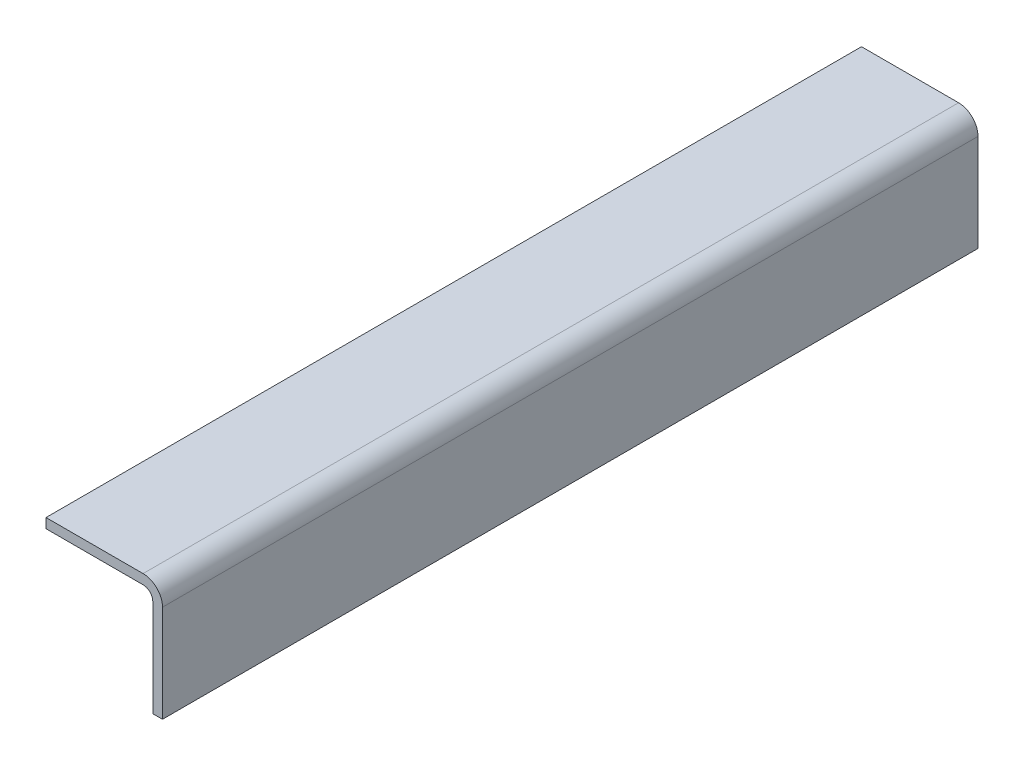
from build123d import *

# Parameters (mm, degrees)
BOSS_EXTRUDE1_DEPTH = 133.35
FILLET2_R           = 3.175
FILLET3_R           = 6.35


with BuildPart() as part:
    # Sketch1 → Boss-Extrude1 (new, symmetric)
    with BuildSketch(Plane.XY):
        Polygon((-3.175, 0), (0, 0), (0, 38.1), (-38.1, 38.1), (-38.1, 34.925), (-3.175, 34.925), align=None)
    extrude(amount=BOSS_EXTRUDE1_DEPTH, both=True)

    # Fillet2
    fillet2_edges = [part.edges().sort_by_distance(p)[0] for p in [
        (-3.175, 34.925, 0),
    ]]
    fillet(fillet2_edges, radius=FILLET2_R)

    # Fillet3
    fillet3_edges = [part.edges().sort_by_distance(p)[0] for p in [
        (0, 38.1, 0),
    ]]
    fillet(fillet3_edges, radius=FILLET3_R)


solid = part.part
